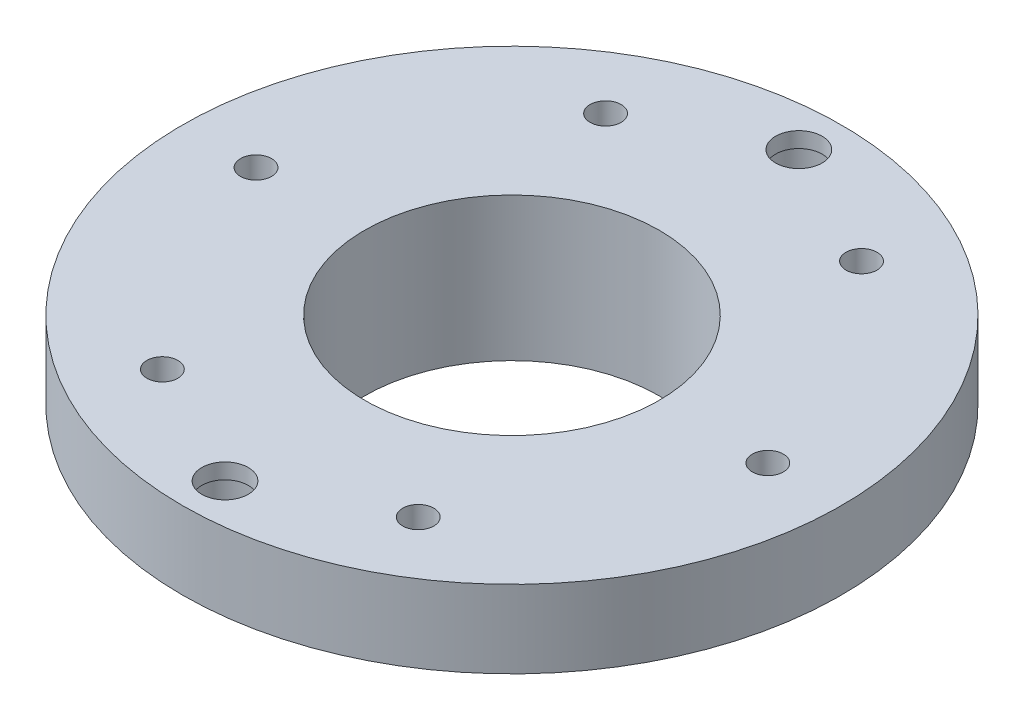
from build123d import *

# Parameters (mm, degrees)
SKETCH1_R           = 21.25
BOSS_EXTRUDE1_DEPTH = 5
SKETCH2_R           = 1.5
CUT_EXTRUDE1_DEPTH  = 5
SKETCH3_R           = 2
CUT_EXTRUDE2_DEPTH  = 4
CIRPATTERN1_COUNT   = 2
SKETCH5_R           = 14
BOSS_EXTRUDE2_DEPTH = 0.25
SKETCH6_R           = 12.575
BOSS_EXTRUDE3_DEPTH = 4
CHAMFER1_SIZE       = 0.5
SKETCH7_R           = 9.5
CUT_EXTRUDE3_DEPTH  = 9.25
SKETCH8_R           = 1
CUT_EXTRUDE4_DEPTH  = 4
CIRPATTERN2_COUNT   = 6


with BuildPart() as part:
    # Sketch1 → Boss-Extrude1 (new body)
    with BuildSketch(Plane(origin=(0, 0, 0), x_dir=(1, 0, 0), z_dir=(0, 1, 0))):
        with Locations(Location((0, 0, 0), (0, 0, 270))):
            Circle(SKETCH1_R)
    extrude(amount=BOSS_EXTRUDE1_DEPTH)

    # Sketch2 → Cut-Extrude1 (cut)
    with BuildSketch(Plane(origin=(0, 5, 0), x_dir=(1, 0, 0), z_dir=(0, 1, 0))):
        with Locations(Location((0, 18.5, 0), (0, 0, 270))):
            Circle(SKETCH2_R)
    cut_extrude1 = extrude(amount=-CUT_EXTRUDE1_DEPTH, mode=Mode.SUBTRACT)

    # Sketch3 → Cut-Extrude2 (cut)
    with BuildSketch(Plane.XZ):
        with Locations(Location((0, -18.5, 0), (0, 0, 270))):
            Circle(SKETCH3_R)
    cut_extrude2 = extrude(amount=-CUT_EXTRUDE2_DEPTH, mode=Mode.SUBTRACT)

    # CirPattern1: Cut-Extrude1, Cut-Extrude2 ×2 about axis
    cirpattern1_axis = Axis((0, 0, 0), (0, 1, 0))
    add([cut_extrude1.rotate(cirpattern1_axis, i * 360 / CIRPATTERN1_COUNT) for i in range(1, CIRPATTERN1_COUNT)], mode=Mode.SUBTRACT)
    add([cut_extrude2.rotate(cirpattern1_axis, i * 360 / CIRPATTERN1_COUNT) for i in range(1, CIRPATTERN1_COUNT)], mode=Mode.SUBTRACT)

    # Sketch5 → Boss-Extrude2 (add)
    with BuildSketch(Plane.XZ):
        with Locations(Location((0, 0, 0), (0, 0, 270))):
            Circle(SKETCH5_R)
    extrude(amount=BOSS_EXTRUDE2_DEPTH)

    # Sketch6 → Boss-Extrude3 (add)
    with BuildSketch(Plane.XZ.offset(0.25)):
        with Locations(Location((0, 0, 0), (0, 0, 270))):
            Circle(SKETCH6_R)
    extrude(amount=BOSS_EXTRUDE3_DEPTH)

    # Chamfer1
    chamfer1_edges = [part.edges().sort_by_distance(p)[0] for p in [
        (0, -4.25, 12.575),
    ]]
    chamfer(chamfer1_edges, length=CHAMFER1_SIZE)

    # Sketch7 → Cut-Extrude3 (cut)
    with BuildSketch(Plane.XZ.offset(4.25)):
        with Locations(Location((0, 0, 0), (0, 0, 270))):
            Circle(SKETCH7_R)
    extrude(amount=-CUT_EXTRUDE3_DEPTH, mode=Mode.SUBTRACT)

    # Sketch8 → Cut-Extrude4 (cut)
    with BuildSketch(Plane(origin=(0, 5, 0), x_dir=(1, 0, 0), z_dir=(0, 1, 0))):
        with Locations(Location((8.25, 14.289419162, 0), (0, 0, 270))):
            Circle(SKETCH8_R)
    cut_extrude4 = extrude(amount=-CUT_EXTRUDE4_DEPTH, mode=Mode.SUBTRACT)

    # CirPattern2: Cut-Extrude4 ×6 about axis
    cirpattern2_axis = Axis((0, 0, 0), (0, 1, 0))
    for i in range(1, CIRPATTERN2_COUNT):
        add(cut_extrude4.rotate(cirpattern2_axis, i * 360 / CIRPATTERN2_COUNT), mode=Mode.SUBTRACT)


solid = part.part
